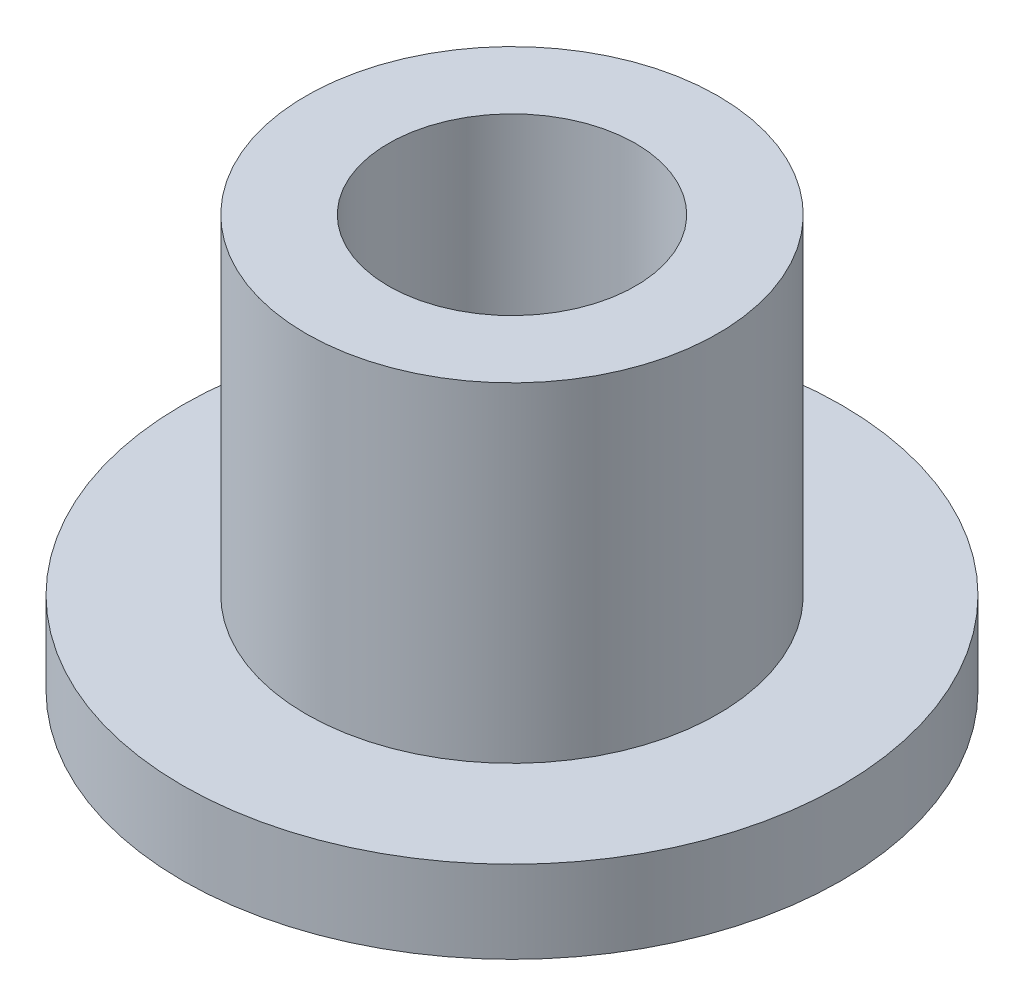
from build123d import *

# Parameters (mm, degrees)
SZKIC1_R                    = 4
SZKIC1_R_2                  = 1.5
DODANIE_WYCI_GNI_CIE1_DEPTH = 2
SZKIC2_R                    = 2.5
SZKIC2_R_2                  = 1.5
DODANIE_WYCI_GNI_CIE2_DEPTH = 4
SFAZOWANIE1_SIZE            = 1
SFAZOWANIE1_SIZE2           = 1.732050808


with BuildPart() as part:
    # Szkic1 → Dodanie-wyciągnięcie1 (new body)
    with BuildSketch(Plane(origin=(0, 0, 0), x_dir=(1, 0, 0), z_dir=(0, 1, 0))):
        with Locations(Location((0, 0, 0), (0, 0, 270))):
            Circle(SZKIC1_R)
        with Locations(Location((0, 0, 0), (0, 0, 270))):
            Circle(SZKIC1_R_2, mode=Mode.SUBTRACT)
    extrude(amount=DODANIE_WYCI_GNI_CIE1_DEPTH)

    # Szkic2 → Dodanie-wyciągnięcie2 (add)
    with BuildSketch(Plane(origin=(0, 2, 0), x_dir=(1, 0, 0), z_dir=(0, 1, 0))):
        with Locations(Location((0, 0, 0), (0, 0, 270))):
            Circle(SZKIC2_R)
        with Locations(Location((0, 0, 0), (0, 0, 270))):
            Circle(SZKIC2_R_2, mode=Mode.SUBTRACT)
    extrude(amount=DODANIE_WYCI_GNI_CIE2_DEPTH)

    # Sfazowanie1
    sfazowanie1_edges = [part.edges().sort_by_distance(p)[0] for p in [
        (0, 0, -4),
    ]]
    sfazowanie1_side = [part.faces().sort_by_distance(p)[0] for p in [
        (0, 1, -4),
    ]]
    chamfer(sfazowanie1_edges, length=SFAZOWANIE1_SIZE, length2=SFAZOWANIE1_SIZE2, reference=sfazowanie1_side[0])


solid = part.part
